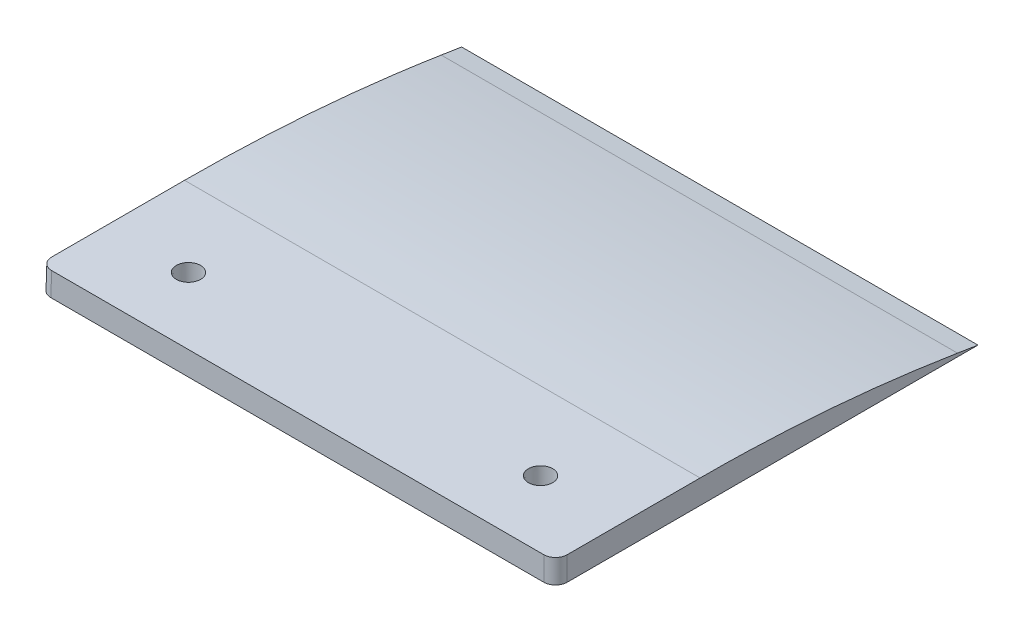
from build123d import *

# Parameters (mm, degrees)
SKETCH_1_W      = 220
SKETCH_1_H      = 180
SKETCH_1_R      = 5
EXTRUDE_1_DEPTH = 10
EXTRUDE_1_DRAFT = 1
FILLET_1_R      = 5
CHAMFER_1_SIZE  = 10
CHAMFER_1_SIZE2 = 62.953374933
FILLET_2_R      = 700


with BuildPart() as part:
    # 草图1 → 凸台-拉伸1 (with draft: the straight prism first)
    with BuildSketch(Plane(origin=(0, 0, 0), x_dir=(1, 0, 0), z_dir=(0, 1, 0))):
        Rectangle(SKETCH_1_W, SKETCH_1_H)
        with Locations((-75, -61.363636364)):
            Circle(SKETCH_1_R, mode=Mode.SUBTRACT)
        with Locations((75, -61.363636364)):
            Circle(SKETCH_1_R, mode=Mode.SUBTRACT)
    extrude(amount=EXTRUDE_1_DEPTH)
    # 凸台-拉伸1: the draft: its side faces are tilted about the plane it starts from
    extrude_1_sides = [part.faces().sort_by_distance(p)[0] for p in [
        (0, 5, 90),
        (110, 5, 0),
        (0, 5, -90),
        (-110, 5, 0),
        (-80, 5, 61.363636364),
        (70, 5, 61.363636364),
    ]]
    draft(extrude_1_sides, Plane(origin=(0, 0, 0), x_dir=(1, 0, 0), z_dir=(0, 1, 0)), EXTRUDE_1_DRAFT)

    # 圆角1
    fillet_1_edges = [part.edges().sort_by_distance(p)[0] for p in [
        (109.912724675, 5, 89.912724675),
        (-109.912724675, 5, 89.912724675),
    ]]
    fillet(fillet_1_edges, radius=FILLET_1_R)

    # 倒角1
    chamfer_1_edges = [part.edges().sort_by_distance(p)[0] for p in [
        (0, 10, -89.825449351),
    ]]
    chamfer_1_side = [part.faces().sort_by_distance(p)[0] for p in [
        (0, 4.998676597, -89.912747775),
    ]]
    chamfer(chamfer_1_edges, length=CHAMFER_1_SIZE, length2=CHAMFER_1_SIZE2, reference=chamfer_1_side[0])

    # 圆角2
    fillet_2_edges = [part.edges().sort_by_distance(p)[0] for p in [
        (0, 10, -26.872074418),
    ]]
    fillet(fillet_2_edges, radius=FILLET_2_R)


solid = part.part
